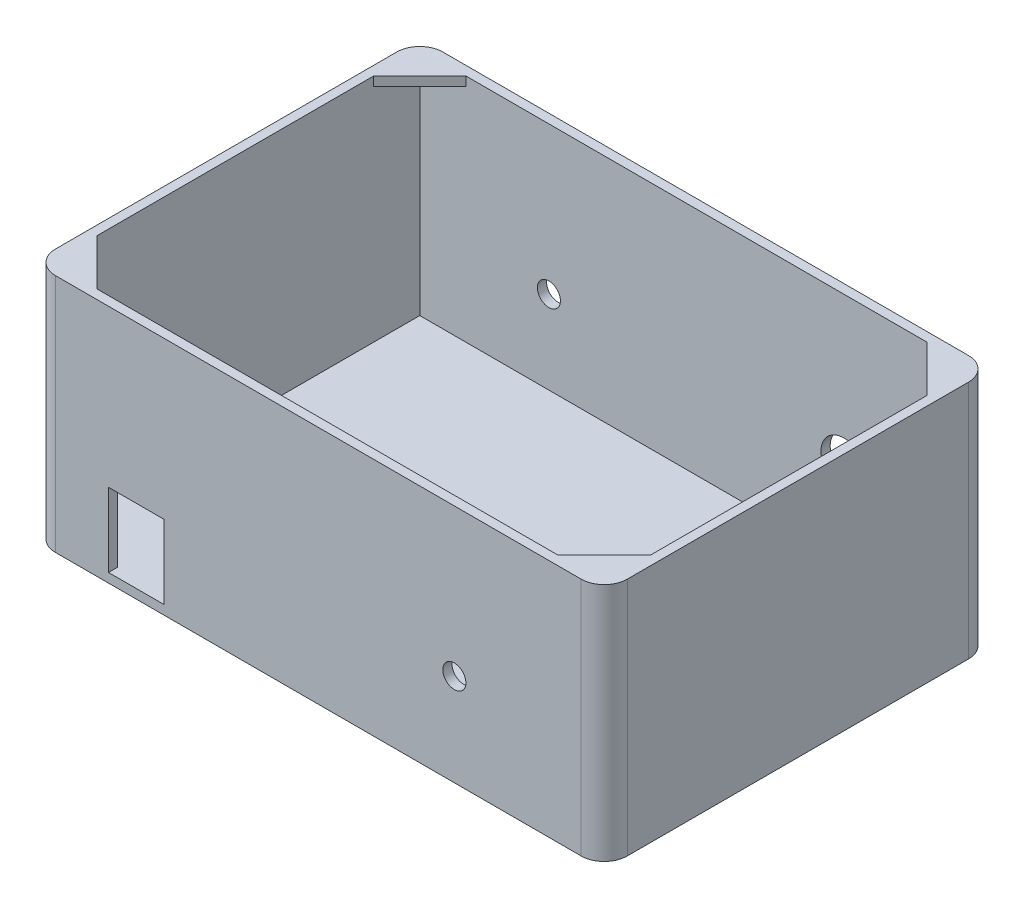
from build123d import *

# Parameters (mm, degrees)
SKETCH1_W           = 120
SKETCH1_H           = 80
BOSS_EXTRUDE1_DEPTH = 2
SKETCH1_3_W         = 124
SKETCH1_3_H         = 84
SKETCH1_3_W_2       = 120
SKETCH1_3_H_2       = 80
BOSS_EXTRUDE2_DEPTH = 52
SKETCH2_W           = 12
SKETCH2_H           = 16
CUT_EXTRUDE1_DEPTH  = 2
SKETCH3_R           = 2.5
CUT_EXTRUDE3_DEPTH  = 2
SKETCH5_R           = 5
SKETCH5_R_2         = 2.5
CUT_EXTRUDE6_DEPTH  = 2
FILLET1_R           = 5
FILLET2_R           = 5
FILLET3_R           = 5
FILLET4_R           = 5
BOSS_EXTRUDE3_DEPTH = 2


with BuildPart() as part:
    # Sketch1 → Boss-Extrude1 (new body)
    with BuildSketch(Plane(origin=(0, 0, 0), x_dir=(1, 0, 0), z_dir=(0, 1, 0))):
        Rectangle(SKETCH1_W, SKETCH1_H)
    extrude(amount=BOSS_EXTRUDE1_DEPTH)

    # Sketch1<3> → Boss-Extrude2 (add)
    with BuildSketch(Plane(origin=(0, 0, 0), x_dir=(1, 0, 0), z_dir=(0, 1, 0))):
        Rectangle(SKETCH1_3_W, SKETCH1_3_H)
        Rectangle(SKETCH1_3_W_2, SKETCH1_3_H_2, mode=Mode.SUBTRACT)
    extrude(amount=BOSS_EXTRUDE2_DEPTH)

    # Sketch2 → Cut-Extrude1 (cut)
    with BuildSketch(Plane.XY.offset(42)):
        with Locations((-39.5, 10)):
            Rectangle(SKETCH2_W, SKETCH2_H)
    extrude(amount=-CUT_EXTRUDE1_DEPTH, mode=Mode.SUBTRACT)

    # Sketch3 → Cut-Extrude3 (cut)
    with BuildSketch(Plane.XY.offset(42)):
        with Locations((29.5, 20)):
            Circle(SKETCH3_R)
    extrude(amount=-CUT_EXTRUDE3_DEPTH, mode=Mode.SUBTRACT)

    # Sketch5 → Cut-Extrude6 (cut)
    with BuildSketch(Plane(origin=(0, 0, -42), x_dir=(-1, 0, 0), z_dir=(0, 0, -1))):
        with Locations((-32, 20)):
            Circle(SKETCH5_R)
        with Locations((32, 20)):
            Circle(SKETCH5_R_2)
    extrude(amount=-CUT_EXTRUDE6_DEPTH, mode=Mode.SUBTRACT)

    # Fillet1
    fillet1_edges = [part.edges().sort_by_distance(p)[0] for p in [
        (62, 26, -42),
    ]]
    fillet(fillet1_edges, radius=FILLET1_R)

    # Fillet2
    fillet2_edges = [part.edges().sort_by_distance(p)[0] for p in [
        (62, 26, 42),
    ]]
    fillet(fillet2_edges, radius=FILLET2_R)

    # Fillet3
    fillet3_edges = [part.edges().sort_by_distance(p)[0] for p in [
        (-62, 26, -42),
    ]]
    fillet(fillet3_edges, radius=FILLET3_R)

    # Fillet4
    fillet4_edges = [part.edges().sort_by_distance(p)[0] for p in [
        (-62, 26, 42),
    ]]
    fillet(fillet4_edges, radius=FILLET4_R)

    # Sketch6 → Boss-Extrude3 (add)
    with BuildSketch(Plane(origin=(0, 52, 0), x_dir=(1, 0, 0), z_dir=(0, 1, 0))):
        Polygon((-50, 40), (-60, 30), (-60, 40), align=None)
        Polygon((-60, -30), (-60, -40), (-50, -40), align=None)
        Polygon((50, -40), (60, -30), (60, -40), align=None)
        Polygon((60, 30), (60, 40), (50, 40), align=None)
    extrude(amount=-BOSS_EXTRUDE3_DEPTH)


solid = part.part
